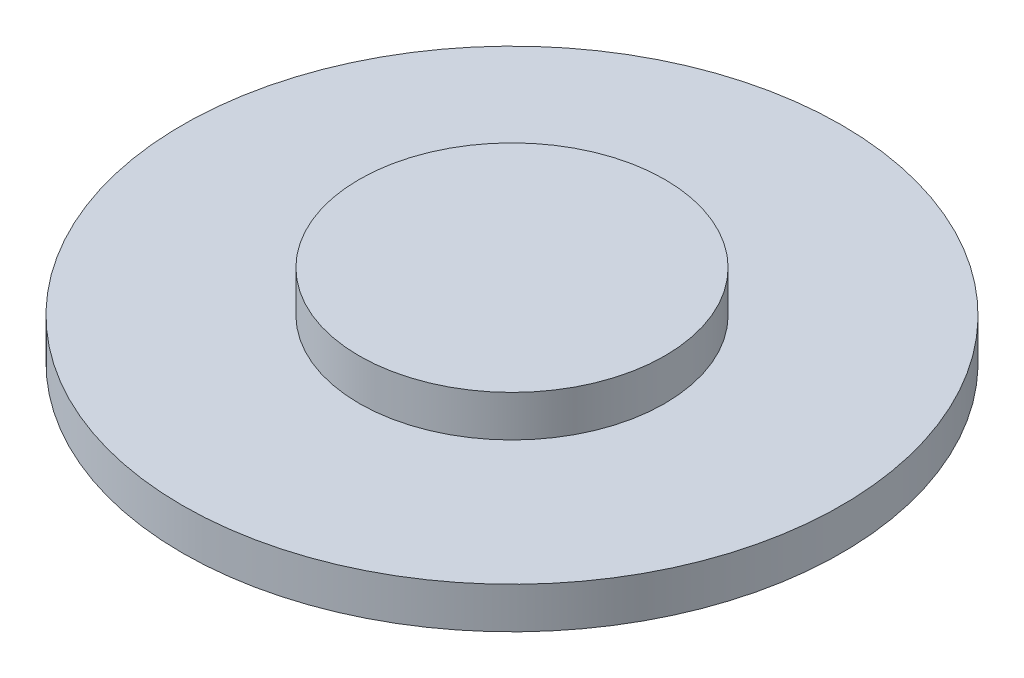
from build123d import *


with BuildPart() as part:
    # Esboço1 → Revolução1 (revolve)
    with BuildSketch(Plane(origin=(0, 0, 0), x_dir=(-1, 0, 0), z_dir=(0, 0, -1)), mode=Mode.PRIVATE) as revolu_o1_sk:
        Polygon((-40, -5), (0, -5), (0, 5), (-18.55, 5), (-18.55, 0), (-40, 0), align=None)
    revolve(revolu_o1_sk.sketch.rotate(Axis((0, -5, 0), (0, 1, 0)), 270), axis=Axis((0, -5, 0), (0, 1, 0)))


solid = part.part
